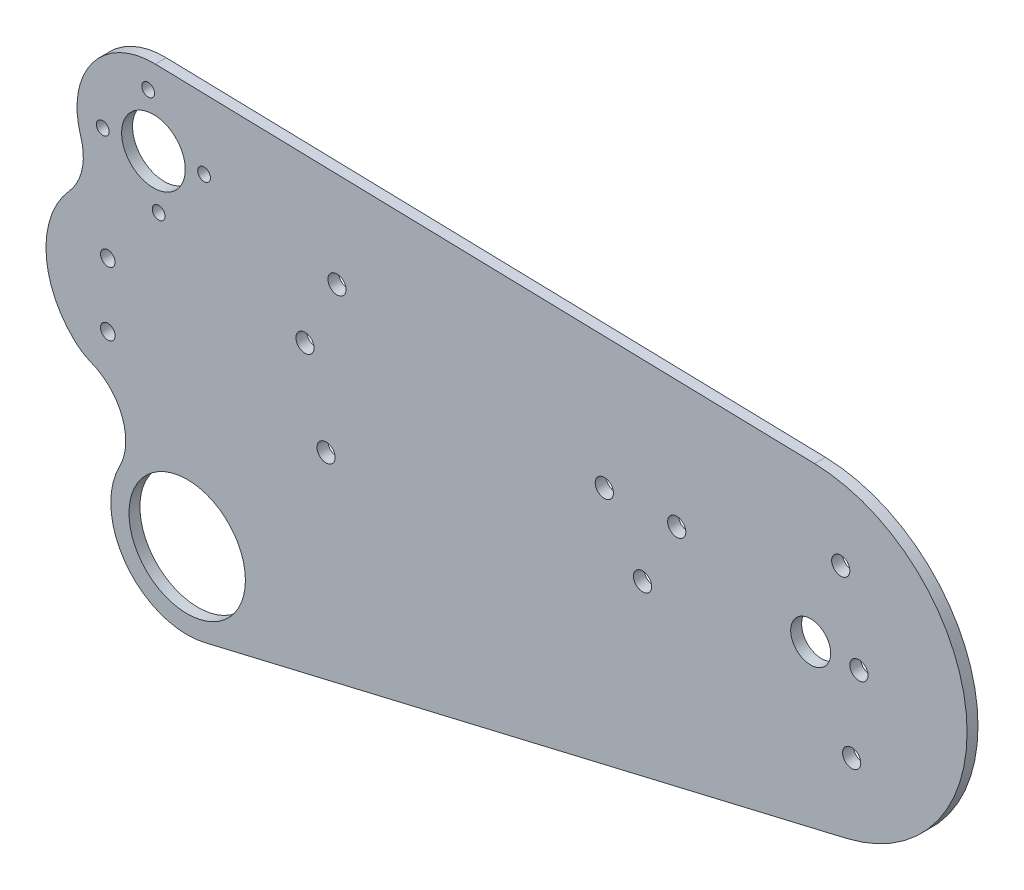
from build123d import *

# Parameters (mm, degrees)
SKETCH1_R           = 2
SKETCH1_R_2         = 2.5
SKETCH1_R_3         = 5.5
SKETCH1_R_4         = 1.75
SKETCH1_R_5         = 8.75
SKETCH1_R_6         = 16
BOSS_EXTRUDE1_DEPTH = 3


with BuildPart() as part:
    # Sketch1 → Boss-Extrude1 (new body)
    with BuildSketch(Plane.XY):
        with BuildLine():
            Line((-101.659864494, -83.45932429), (74.802197756, -41.852361745))
            ThreePointArc((74.802197756, -41.852361745), (107.704647438, 4.436019045), (66.002975735, 42.986712534))
            Line((66.002975735, 42.986712534), (-115.241855356, 47.493510774))
            ThreePointArc((-115.241855356, 47.493510774), (-132.576190146, 39.08356421), (-135.758964721, 20.081556162))
            ThreePointArc((-135.758964721, 20.081556162), (-135.373925263, 12.354995282), (-138.890242706, 5.464167316))
            ThreePointArc((-138.890242706, 5.464167316), (-145.2866753, -12.223575588), (-137.542861296, -29.364285714))
            ThreePointArc((-137.542861296, -29.364285714), (-135.311942722, -31.117537591), (-132.790777729, -32.419312113))
            ThreePointArc((-132.790777729, -32.419312113), (-124.308939641, -41.145198886), (-125.08868845, -53.289113787))
            ThreePointArc((-125.08868845, -53.289113787), (-123.065402539, -75.899910202), (-101.659864494, -83.45932429))
        make_face()
        with Locations((-128.3, -22.75)):
            Circle(SKETCH1_R, mode=Mode.SUBTRACT)
        with Locations((-68.3, -21.5)):
            Circle(SKETCH1_R_2, mode=Mode.SUBTRACT)
        with Locations((-128.3, -5.25)):
            Circle(SKETCH1_R, mode=Mode.SUBTRACT)
        with Locations((-74.1, 1.7)):
            Circle(SKETCH1_R_2, mode=Mode.SUBTRACT)
        with Locations((18.7, -8.7)):
            Circle(SKETCH1_R_2, mode=Mode.SUBTRACT)
        with Locations((76.2, -22)):
            Circle(SKETCH1_R_2, mode=Mode.SUBTRACT)
        with Locations((8.2, 8.3)):
            Circle(SKETCH1_R_2, mode=Mode.SUBTRACT)
        with Locations((64.934076539, 0)):
            Circle(SKETCH1_R_3, mode=Mode.SUBTRACT)
        with Locations((78.2, -0.1)):
            Circle(SKETCH1_R_2, mode=Mode.SUBTRACT)
        with Locations((-114.319590013, 12.574697906)):
            Circle(SKETCH1_R_4, mode=Mode.SUBTRACT)
        with Locations((-129.68917795, 25.055714157)):
            Circle(SKETCH1_R_4, mode=Mode.SUBTRACT)
        with Locations((-65.3, 20)):
            Circle(SKETCH1_R_2, mode=Mode.SUBTRACT)
        with Locations((-115.763875856, 26.5)):
            Circle(SKETCH1_R_5, mode=Mode.SUBTRACT)
        with Locations((-101.838573763, 27.944285843)):
            Circle(SKETCH1_R_4, mode=Mode.SUBTRACT)
        with Locations((-117.208161699, 40.425302094)):
            Circle(SKETCH1_R_4, mode=Mode.SUBTRACT)
        with Locations((28.1, 9)):
            Circle(SKETCH1_R_2, mode=Mode.SUBTRACT)
        with Locations((73.2, 22.3)):
            Circle(SKETCH1_R_2, mode=Mode.SUBTRACT)
        with Locations((-106.479181151, -63.019799174)):
            Circle(SKETCH1_R_6, mode=Mode.SUBTRACT)
    extrude(amount=BOSS_EXTRUDE1_DEPTH)


solid = part.part
